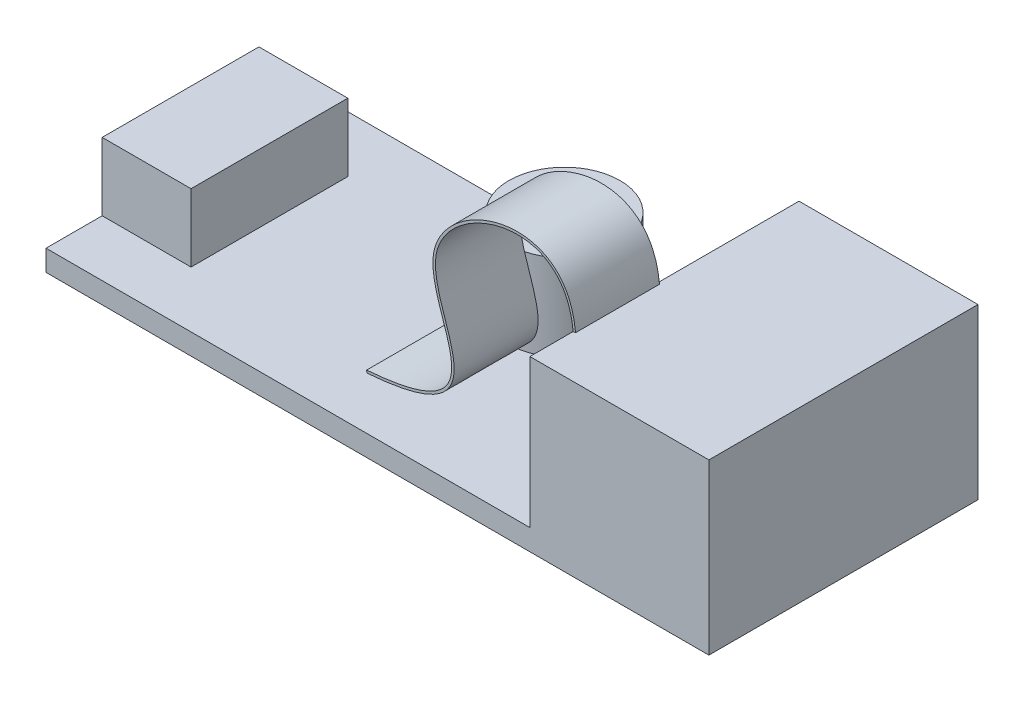
from build123d import *

# Parameters (mm, degrees)
SKETCH1_W           = 53.7
SKETCH1_H           = 21.8
BOSS_EXTRUDE1_DEPTH = 1.7
SKETCH2_W           = 14.5
SKETCH2_H           = 21.8
BOSS_EXTRUDE2_DEPTH = 12
BOSS_EXTRUDE3_DEPTH = 6.8
SKETCH4_R           = 4.5
BOSS_EXTRUDE4_DEPTH = 7
SKETCH5_W           = 7.2
SKETCH5_H           = 12.7
BOSS_EXTRUDE5_DEPTH = 5.5
SKETCH6_W           = 6
SKETCH6_H           = 8
BOSS_EXTRUDE6_DEPTH = 3.5


with BuildPart() as part:
    # Sketch1 → Boss-Extrude1 (new body)
    with BuildSketch(Plane(origin=(0, 0, 0), x_dir=(1, 0, 0), z_dir=(0, 1, 0))):
        with Locations((26.85, 10.9)):
            Rectangle(SKETCH1_W, SKETCH1_H)
    extrude(amount=BOSS_EXTRUDE1_DEPTH)

    # Sketch2 → Boss-Extrude2 (add)
    with BuildSketch(Plane(origin=(0, 1.7, 0), x_dir=(1, 0, 0), z_dir=(0, 1, 0))):
        with Locations((46.45, 10.9)):
            Rectangle(SKETCH2_W, SKETCH2_H)
    extrude(amount=BOSS_EXTRUDE2_DEPTH)

    # Sketch4 → Boss-Extrude4 (add)
    with BuildSketch(Plane(origin=(0, 1.7, 0), x_dir=(1, 0, 0), z_dir=(0, 1, 0))):
        with Locations(Location((25.5, 16.5, 0), (0, 0, 90))):
            Circle(SKETCH4_R)
    extrude(amount=BOSS_EXTRUDE4_DEPTH)

    # Sketch5 → Boss-Extrude5 (add)
    with BuildSketch(Plane(origin=(0, 1.7, 0), x_dir=(1, 0, 0), z_dir=(0, 1, 0))):
        with Locations((3.6, 10.9)):
            Rectangle(SKETCH5_W, SKETCH5_H)
    extrude(amount=BOSS_EXTRUDE5_DEPTH)

    # Sketch6 → Boss-Extrude6 (add)
    with BuildSketch(Plane.XZ):
        with Locations((3, -10.9)):
            Rectangle(SKETCH6_W, SKETCH6_H)
    extrude(amount=BOSS_EXTRUDE6_DEPTH)


with BuildPart() as body_2:
    # Sketch3 → Boss-Extrude3 (new body)
    with BuildSketch(Plane.XY.offset(-3.5)):
        with BuildLine():
            Line((39.2, 13.7), (39.399104786, 13.718901958))
            add(Edge.make_bspline(
                [(39.399104786, 13.718901958), (39.37716637, 13.949991445), (39.312900137, 14.422722145), (39.121163674, 15.257604809), (38.762934197, 16.168832029), (38.168169426, 17.036855896), (37.189876498, 17.910500102), (35.699484662, 18.487221271), (33.719854527, 18.478167154), (31.745006015, 17.894754952), (29.377277148, 16.502877604), (27.780674525, 14.364129981), (27.842717967, 11.932579741), (28.357836119, 10.111287242), (28.994339416, 8.332214987), (29.422219371, 6.674833479), (29.330934537, 5.254184283), (28.614392477, 4.277524246), (27.439642851, 3.606350644), (26.21323705, 3.181637282), (24.860216287, 2.90360878), (23.583056392, 2.734797552), (22.83643137, 2.666133946), (22.475855855, 2.639010515)],
                knots=[0, 0, 0, 0, 0.015625, 0.03125, 0.0625, 0.09375, 0.125, 0.1875, 0.25, 0.3125, 0.375, 0.5, 0.5625, 0.625, 0.6875, 0.75, 0.8125, 0.875, 0.90625, 0.9375, 0.96875, 0.984375, 1, 1, 1, 1], degree=3))
            Line((22.475855855, 2.639010515), (22.490857993, 2.439573969))
            add(Edge.make_bspline(
                [(39.2, 13.7), (38.487619517, 21.203898001), (19.665936796, 15.106413478), (34.703585042, 3.358247179), (22.490857993, 2.439573969)],
                knots=[0, 0, 0, 0, 0.499649345, 1, 1, 1, 1], degree=3))
        make_face()
    extrude(amount=-BOSS_EXTRUDE3_DEPTH)


solid = Compound([part.part, body_2.part])
